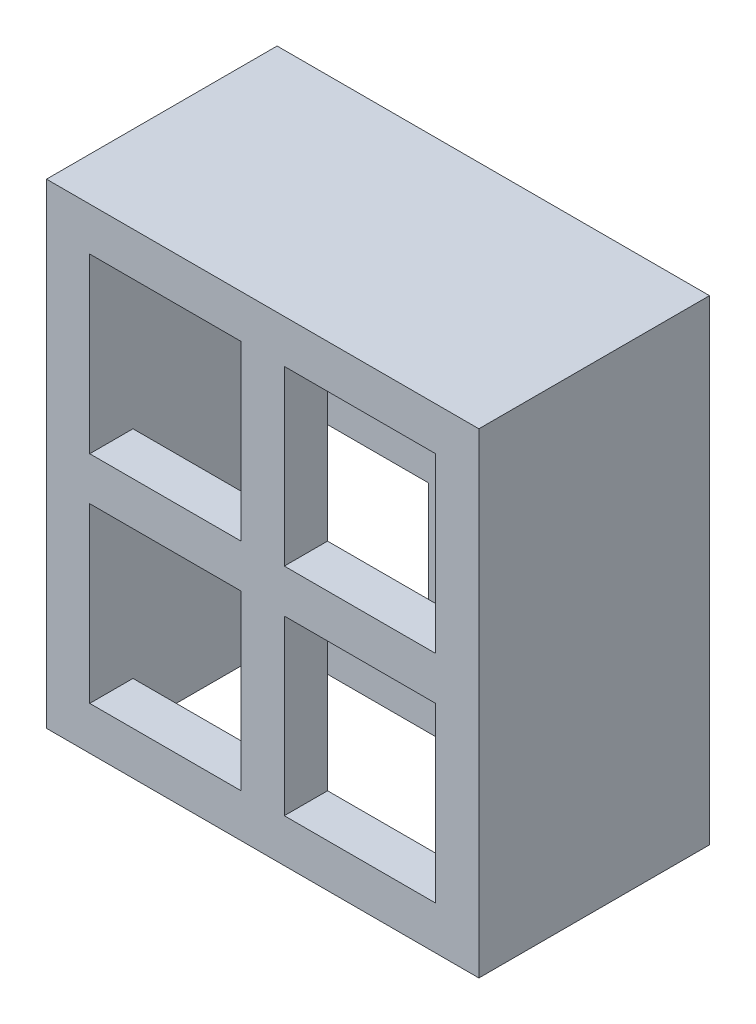
from build123d import *

# Parameters (mm, degrees)
SKETCH1_W           = 15
SKETCH1_H           = 8
BOSS_EXTRUDE2_DEPTH = 18
SKETCH2_W           = 12
SKETCH2_H           = 5
CUT_EXTRUDE1_DEPTH  = 16.5
SKETCH3_W           = 5.25
SKETCH3_H           = 6
CUT_EXTRUDE2_DEPTH  = 8
SKETCH5_W           = 5
SKETCH5_H           = 1.5
CUT_EXTRUDE3_DEPTH  = 15
SKETCH4_W           = 5.25
SKETCH4_H           = 1.5
CUT_EXTRUDE4_DEPTH  = 15
SKETCH6_W           = 15
SKETCH6_H           = 8
CUT_EXTRUDE5_DEPTH  = 1.5


with BuildPart() as part:
    # Sketch1 → Boss-Extrude2 (new body)
    with BuildSketch(Plane(origin=(0, 0, 0), x_dir=(1, 0, 0), z_dir=(0, 1, 0))):
        with Locations((-26.34923581, -20.1983027)):
            Rectangle(SKETCH1_W, SKETCH1_H)
    extrude(amount=BOSS_EXTRUDE2_DEPTH)

    # Sketch2 → Cut-Extrude1 (cut)
    with BuildSketch(Plane(origin=(0, 0, 0), x_dir=(-1, 0, 0), z_dir=(0, -1, 0))):
        with Locations((26.34923581, -20.1983027)):
            Rectangle(SKETCH2_W, SKETCH2_H)
    extrude(amount=-CUT_EXTRUDE1_DEPTH, mode=Mode.SUBTRACT)

    # Sketch3 → Cut-Extrude2 (cut)
    with BuildSketch(Plane.XY.offset(24.1983027)):
        with Locations((-29.72423581, 13.5)):
            Rectangle(SKETCH3_W, SKETCH3_H)
        with Locations((-22.97423581, 13.5)):
            Rectangle(SKETCH3_W, SKETCH3_H)
        with Locations((-22.97423581, 6)):
            Rectangle(SKETCH3_W, SKETCH3_H)
        with Locations((-29.72423581, 6)):
            Rectangle(SKETCH3_W, SKETCH3_H)
    extrude(amount=-CUT_EXTRUDE2_DEPTH, mode=Mode.SUBTRACT)

    # Sketch5 → Cut-Extrude3 (cut)
    with BuildSketch(Plane(origin=(-18.84923581, 0, 0), x_dir=(0, 0, -1), z_dir=(1, 0, 0))):
        with Locations((-20.1983027, 0.75)):
            Rectangle(SKETCH5_W, SKETCH5_H)
    extrude(amount=-CUT_EXTRUDE3_DEPTH, mode=Mode.SUBTRACT)

    # Sketch4 → Cut-Extrude4 (cut)
    with BuildSketch(Plane.XY.offset(24.1983027)):
        with Locations((-29.72423581, 0.75)):
            Rectangle(SKETCH4_W, SKETCH4_H)
        with Locations((-22.97423581, 0.75)):
            Rectangle(SKETCH4_W, SKETCH4_H)
    extrude(amount=-CUT_EXTRUDE4_DEPTH, mode=Mode.SUBTRACT)

    # Sketch6 → Cut-Extrude5 (cut)
    with BuildSketch(Plane.XZ):
        with Locations((-26.34923581, 20.1983027)):
            Rectangle(SKETCH6_W, SKETCH6_H)
    extrude(amount=-CUT_EXTRUDE5_DEPTH, mode=Mode.SUBTRACT)


solid = part.part
